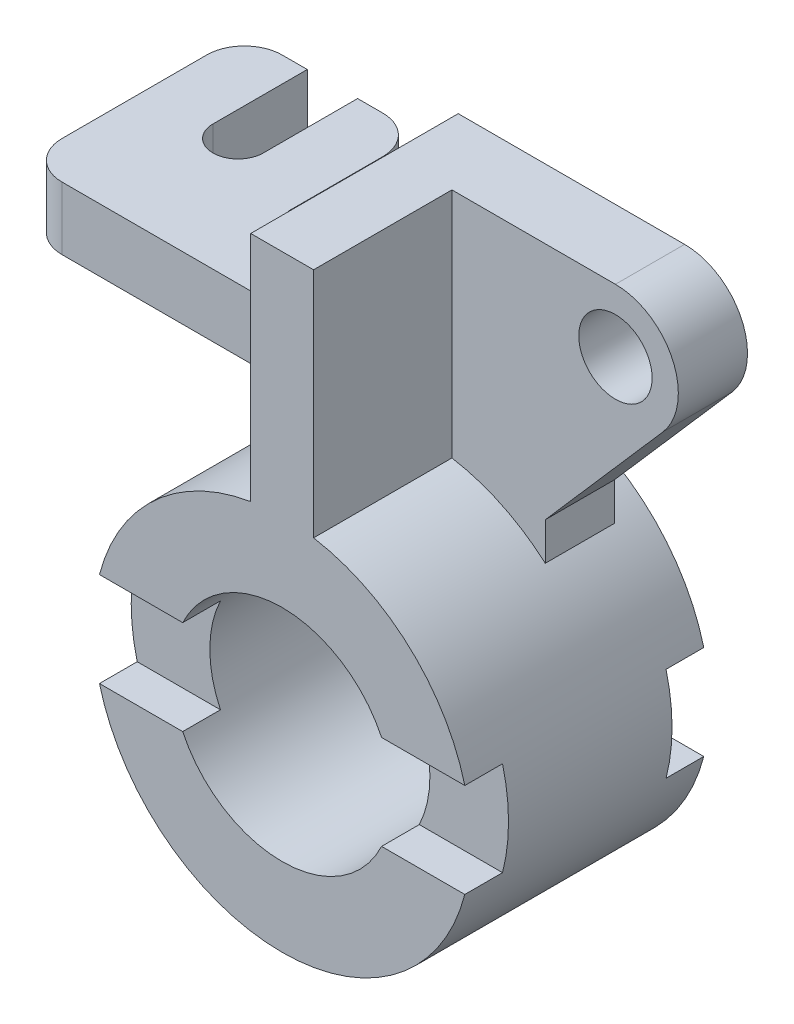
from build123d import *

# Parameters (mm, degrees)
SKETCH1_R           = 30
SKETCH1_R_2         = 17.5
BOSS_EXTRUDE1_DEPTH = 38
BOSS_EXTRUDE2_START = -33
BOSS_EXTRUDE2_DEPTH = 33
SKETCH6_W           = 11
SKETCH6_H           = 36.919601085
BOSS_EXTRUDE3_DEPTH = 41.84
SKETCH8_R           = 5.835
CUT_EXTRUDE2_DEPTH  = 41.84
BOSS_EXTRUDE4_DEPTH = 11
SKETCH13_W          = 14
SKETCH13_H          = 10
BOSS_EXTRUDE7_DEPTH = 55
SKETCH14_W          = 5
SKETCH14_H          = 14
CUT_EXTRUDE3_DEPTH  = 2
BOSS_EXTRUDE8_DEPTH = 10
CUT_EXTRUDE4_DEPTH  = 100.425509369
SKETCH18_W          = 27.083405909
SKETCH18_H          = 15
CUT_EXTRUDE5_DEPTH  = 6


with BuildPart() as part:
    # Sketch1 → Boss-Extrude1 (new body)
    with BuildSketch(Plane.XY):
        Circle(SKETCH1_R)
        Circle(SKETCH1_R_2, mode=Mode.SUBTRACT)
    extrude(amount=BOSS_EXTRUDE1_DEPTH)

    # Sketch3 → Boss-Extrude2 (add)
    with BuildSketch(Plane.XY.offset(38).offset(BOSS_EXTRUDE2_START)):
        with BuildLine():
            Line((5, 29.580398915), (5, 66.5))
            Line((5, 66.5), (-5, 66.5))
            Line((-5, 66.5), (-5, 29.580398915))
            ThreePointArc((-5, 29.580398915), (0, 30), (5, 29.580398915))
        make_face()
    extrude(amount=BOSS_EXTRUDE2_DEPTH)

    # Sketch6 → Boss-Extrude3 (add)
    with BuildSketch(Plane(origin=(5, 0, 0), x_dir=(0, 0, -1), z_dir=(1, 0, 0))):
        with Locations((-10.5, 48.040199458)):
            Rectangle(SKETCH6_W, SKETCH6_H)
    extrude(amount=BOSS_EXTRUDE3_DEPTH)

    # Sketch8 → Cut-Extrude2 (cut)
    with BuildSketch(Plane.XY.offset(16)):
        with BuildLine():
            Line((38.535426242, 49.92600948), (19.843134833, 28.5))
            Line((19.843134833, 28.5), (19.843134833, 22.5))
            Line((19.843134833, 22.5), (50.730835644, 21.613123559))
            Line((50.730835644, 21.613123559), (58.316291642, 73.170252493))
            Line((58.316291642, 73.170252493), (32.080152152, 77.030302224))
            Line((32.080152152, 77.030302224), (31, 66.5))
            ThreePointArc((31, 66.5), (40.103293503, 60.638846144), (38.535426242, 49.92600948))
        make_face()
        with Locations((31, 56.5)):
            Circle(SKETCH8_R)
    extrude(amount=-CUT_EXTRUDE2_DEPTH, mode=Mode.SUBTRACT)

    # Sketch11 → Boss-Extrude4 (add)
    with BuildSketch(Plane(origin=(0, 0, 5), x_dir=(-1, 0, 0), z_dir=(0, 0, -1))):
        with BuildLine():
            Line((-19.843134833, 22.5), (-19.843134833, 28.5))
            Line((-19.843134833, 28.5), (-20.785686986, 29.580398915))
            Line((-20.785686986, 29.580398915), (-5, 29.580398915))
            ThreePointArc((-5, 29.580398915), (-12.91620491, 27.077142588), (-19.843134833, 22.5))
        make_face()
    extrude(amount=-BOSS_EXTRUDE4_DEPTH)

    # Sketch13 → Boss-Extrude7 (add)
    with BuildSketch(Plane.ZY.offset(5)):
        with Locations((12, 34.580398915)):
            Rectangle(SKETCH13_W, SKETCH13_H)
    extrude(amount=BOSS_EXTRUDE7_DEPTH)

    # Sketch14 → Cut-Extrude3 (cut)
    with BuildSketch(Plane(origin=(0, 39.580398915, 0), x_dir=(1, 0, 0), z_dir=(0, 1, 0))):
        with Locations((-7.5, -12)):
            Rectangle(SKETCH14_W, SKETCH14_H)
    extrude(amount=-CUT_EXTRUDE3_DEPTH, mode=Mode.SUBTRACT)

    # Sketch15 → Boss-Extrude8 (add)
    with BuildSketch(Plane(origin=(0, 39.580398915, 0), x_dir=(1, 0, 0), z_dir=(0, 1, 0))):
        with BuildLine():
            Line((-60, 10), (-60, -5))
            Line((-60, -5), (-32, -5))
            Line((-32, -5), (-32, 10))
            ThreePointArc((-32, 10), (-33.757359313, 14.242640687), (-38, 16))
            Line((-38, 16), (-42, 16))
            Line((-42, 16), (-42, 1))
            ThreePointArc((-42, 1), (-46, -3), (-50, 1))
            Line((-50, 1), (-50, 16))
            Line((-50, 16), (-54, 16))
            ThreePointArc((-54, 16), (-58.242640687, 14.242640687), (-60, 10))
        make_face()
    extrude(amount=-BOSS_EXTRUDE8_DEPTH)

    # Sketch16 → Cut-Extrude4 (cut, through all)
    with BuildSketch(Plane(origin=(0, 39.580398915, 0), x_dir=(1, 0, 0), z_dir=(0, 1, 0))):
        with BuildLine():
            ThreePointArc((-54, -19), (-58.242640687, -17.242640687), (-60, -13))
            Line((-60, -13), (-60, -19))
            Line((-60, -19), (-54, -19))
        make_face()
    extrude(amount=-CUT_EXTRUDE4_DEPTH, mode=Mode.SUBTRACT)

    # Sketch18 → Cut-Extrude5 (cut)
    with BuildSketch(Plane(origin=(0, 0, 0), x_dir=(-1, 0, 0), z_dir=(0, 0, -1))):
        with Locations((-23.74070021, 0)):
            Rectangle(SKETCH18_W, SKETCH18_H)
        with Locations((23.74070021, 0)):
            Rectangle(SKETCH18_W, SKETCH18_H)
    cut_extrude5 = extrude(amount=-CUT_EXTRUDE5_DEPTH, mode=Mode.SUBTRACT)

    # Mirror1: Cut-Extrude5 across plane
    add(cut_extrude5.mirror(Plane.XY.offset(19)), mode=Mode.SUBTRACT)


solid = part.part
